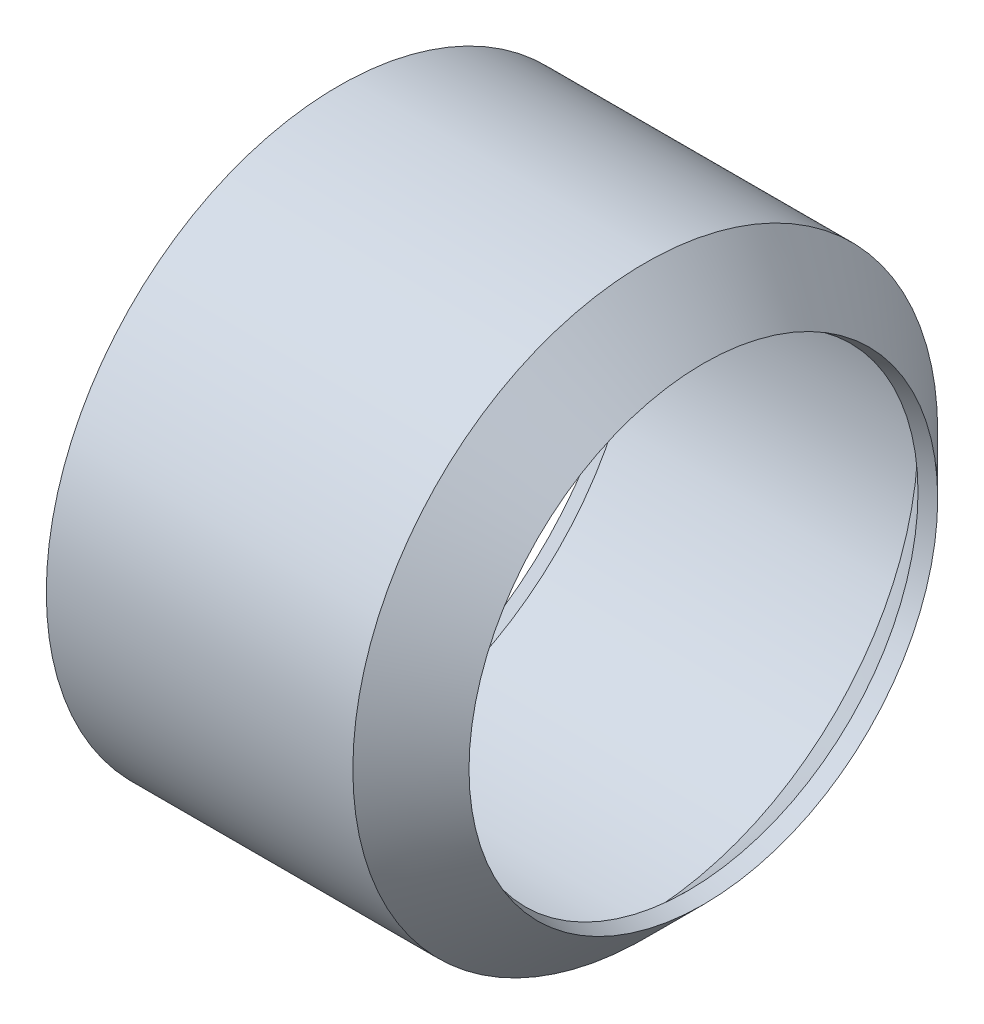
from build123d import *


with BuildPart() as part:
    # Sketch2 → Revolve2 (revolve)
    with BuildSketch(Plane.XY, mode=Mode.PRIVATE) as revolve2_sk:
        Polygon((-12.192, 26.67), (-10.16, 25.4), (15.24, 25.4), (19.657391304, 20.982608696), (21.06299661, 21.373054614), (15.766051224, 26.67), align=None)
    revolve(revolve2_sk.sketch.rotate(Axis((0, 0, 0), (1, 0, 0)), 90), axis=Axis((0, 0, 0), (1, 0, 0)))


solid = part.part
